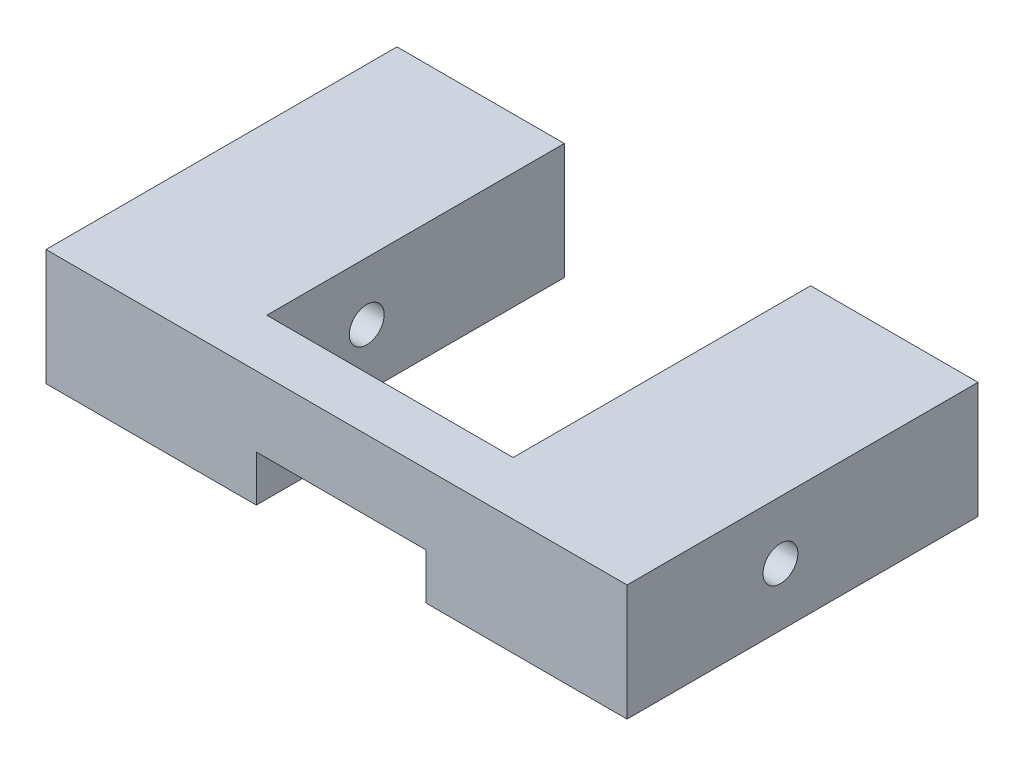
from build123d import *

# Parameters (mm, degrees)
SKETCH1_W           = 25
SKETCH1_H           = 9.6
BOSS_EXTRUDE1_DEPTH = 5
SKETCH2_W           = 10.6
SKETCH2_H           = 7.3
CUT_EXTRUDE1_DEPTH  = 10
SKETCH3_W           = 7.3
SKETCH3_H           = 1.98
CUT_EXTRUDE2_DEPTH  = 10
SKETCH4_R           = 0.75
CUT_EXTRUDE3_DEPTH  = 26
SKETCH6_W           = 7.2
SKETCH6_H           = 5
BOSS_EXTRUDE3_DEPTH = 5.5


with BuildPart() as part:
    # Sketch1 → Boss-Extrude1 (new body)
    with BuildSketch(Plane(origin=(0, 0, 0), x_dir=(1, 0, 0), z_dir=(0, 1, 0))):
        Rectangle(SKETCH1_W, SKETCH1_H)
    extrude(amount=BOSS_EXTRUDE1_DEPTH)

    # Sketch2 → Cut-Extrude1 (cut)
    with BuildSketch(Plane(origin=(0, 5, 0), x_dir=(1, 0, 0), z_dir=(0, 1, 0))):
        with Locations((0, 1.15)):
            Rectangle(SKETCH2_W, SKETCH2_H)
    extrude(amount=-CUT_EXTRUDE1_DEPTH, mode=Mode.SUBTRACT)

    # Sketch3 → Cut-Extrude2 (cut)
    with BuildSketch(Plane(origin=(0, 0, 2.5), x_dir=(-1, 0, 0), z_dir=(0, 0, -1))):
        with Locations((-0.2, 0.99)):
            Rectangle(SKETCH3_W, SKETCH3_H)
    extrude(amount=-CUT_EXTRUDE2_DEPTH, mode=Mode.SUBTRACT)

    # Sketch4 → Cut-Extrude3 (cut)
    with BuildSketch(Plane.ZY.offset(12.5)):
        with Locations((-1.8, 2.5)):
            Circle(SKETCH4_R)
    extrude(amount=-CUT_EXTRUDE3_DEPTH, mode=Mode.SUBTRACT)

    # Sketch6 → Boss-Extrude3 (add)
    with BuildSketch(Plane(origin=(0, 0, -4.8), x_dir=(-1, 0, 0), z_dir=(0, 0, -1))):
        with Locations((-8.9, 2.5)):
            Rectangle(SKETCH6_W, SKETCH6_H)
        with Locations((8.9, 2.5)):
            Rectangle(SKETCH6_W, SKETCH6_H)
    extrude(amount=BOSS_EXTRUDE3_DEPTH)


solid = part.part
